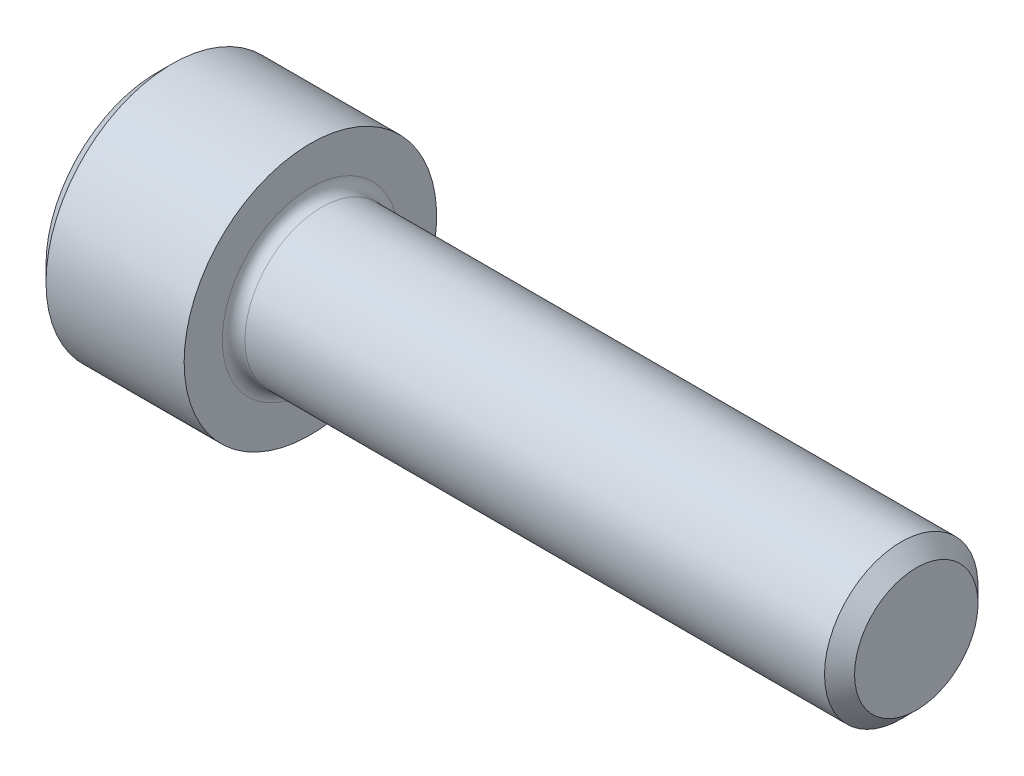
from build123d import *

# Parameters (mm, degrees)
FILLET1_R   = 0.3556
HEX_2_DEPTH = 2.286


with BuildPart() as part:
    # BodySke → Base-Revolve (revolve)
    with BuildSketch(Plane.XY, mode=Mode.PRIVATE) as base_revolve_sk:
        Polygon((0, 0), (0, 3.48615), (0.4826, 3.96875), (4.826, 3.96875), (4.826, 2.413), (23.40356, 2.413), (23.876, 1.94056), (23.876, 0), align=None)
    revolve(base_revolve_sk.sketch.rotate(Axis((-31.75, 0, 0), (1, 0, 0)), 90), axis=Axis((-31.75, 0, 0), (1, 0, 0)))

    # Fillet1
    fillet1_edges = [part.edges().sort_by_distance(p)[0] for p in [
        (4.826, 0, -2.413),
    ]]
    fillet(fillet1_edges, radius=FILLET1_R)

    # Sketch2 → Hex-PreBroach (revolve, cut)
    with BuildSketch(Plane.XY, mode=Mode.PRIVATE) as hex_prebroach_sk:
        Polygon((0, 1.98501), (2.286, 1.98501), (3.432046058, 0), (0, 0), align=None)
    revolve(hex_prebroach_sk.sketch.rotate(Axis((0, 0, 0), (1, 0, 0)), 90), axis=Axis((0, 0, 0), (1, 0, 0)), mode=Mode.SUBTRACT)

    # Sketch3 → Hex 2 (cut)
    with BuildSketch(Plane(origin=(0, 0, 0), x_dir=(0, 0.500000000000001, 0.866025403784438), z_dir=(-1, 0, 0))):
        Polygon((1.146046058, 1.98501), (-1.146046058, 1.98501), (-2.292092116, 0), (-1.146046058, -1.98501), (1.146046058, -1.98501), (2.292092116, 0), align=None)
    extrude(amount=-HEX_2_DEPTH, mode=Mode.SUBTRACT)


solid = part.part
